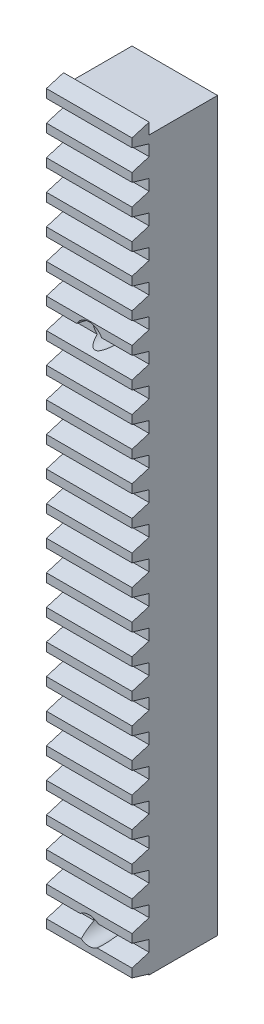
from build123d import *

# Parameters (mm, degrees)
SKETCH_1_W             = 8
SKETCH_1_H             = 85
EXTRUDE_1_DEPTH        = 5
EXTRUDE_2_DEPTH        = 5
PATTERN_LINEAR_1_COUNT = 51
PATTERN_LINEAR_1_PITCH = 3.5
SKETCH_3_R             = 1.6
CUT_EXTRUDE_1_DEPTH    = 46.204424562


with BuildPart() as part:
    # 草图1 → 凸台-拉伸1 (new, symmetric)
    with BuildSketch(Plane(origin=(0, 0, 0), x_dir=(0, 0, -1), z_dir=(1, 0, 0))):
        with Locations((4, 0)):
            Rectangle(SKETCH_1_W, SKETCH_1_H)
    extrude(amount=EXTRUDE_1_DEPTH, both=True)

    # 草图2 → 凸台-拉伸2 (add, symmetric)
    with BuildSketch(Plane(origin=(0, 0, 0), x_dir=(0, 0, -1), z_dir=(1, 0, 0))):
        Polygon((0, -42.4), (-2, -41.8), (-2, -40.8), (0, -40.2), align=None)
    extrude_2 = extrude(amount=EXTRUDE_2_DEPTH, both=True)

    # 阵列(线性)1: 凸台-拉伸2 ×51, 26 skipped
    with Locations(*[(0, i * PATTERN_LINEAR_1_PITCH, 0) for i in range(1, PATTERN_LINEAR_1_COUNT) if i not in (25, 26, 27, 28, 29, 30, 31, 32, 33, 34, 35, 36, 37, 38, 39, 40, 41, 42, 43, 44, 45, 46, 47, 48, 49, 50)]):
        add(extrude_2)

    # 草图3 → 切除-拉伸1 (cut, through all)
    with BuildSketch(Plane(origin=(0, 0, -8), x_dir=(-1, 0, 0), z_dir=(0, 0, -1))):
        with Locations((0, -39.5)):
            Circle(SKETCH_3_R)
        with Locations((0, 20.5)):
            Circle(SKETCH_3_R)
        with Locations((0, 80.5)):
            Circle(SKETCH_3_R)
    extrude(amount=-CUT_EXTRUDE_1_DEPTH, mode=Mode.SUBTRACT)


solid = part.part
